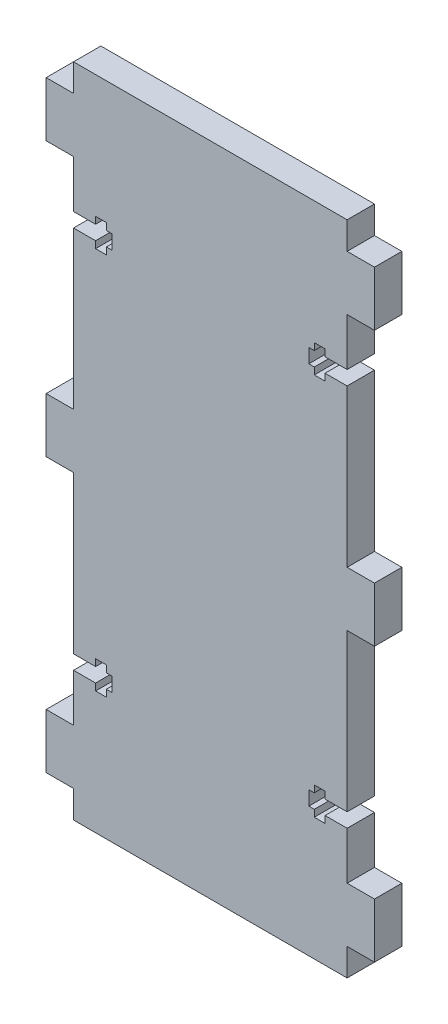
from build123d import *

# Parameters (mm, degrees)
SKETCH1_W           = 63.5
SKETCH1_H           = 152.4
BOSS_EXTRUDE1_DEPTH = 6.35
SKETCH2_W           = 6.35
SKETCH2_H           = 12.7
BOSS_EXTRUDE3_DEPTH = 6.35
SKETCH4_W           = 8.89
SKETCH4_H           = 3.302
SKETCH4_W_2         = 2.5
SKETCH4_H_2         = 6.5
CUT_EXTRUDE4_DEPTH  = 6.35


with BuildPart() as part:
    # Sketch1 → Boss-Extrude1 (new body)
    with BuildSketch(Plane.XY):
        with Locations((31.75, 76.2)):
            Rectangle(SKETCH1_W, SKETCH1_H)
    extrude(amount=BOSS_EXTRUDE1_DEPTH)

    # Sketch2 → Boss-Extrude3 (add)
    with BuildSketch(Plane.XY.offset(6.35)):
        with Locations((-3.175, 76.2)):
            Rectangle(SKETCH2_W, SKETCH2_H)
        with Locations((66.675, 139.7)):
            Rectangle(SKETCH2_W, SKETCH2_H)
        with Locations((66.675, 76.2)):
            Rectangle(SKETCH2_W, SKETCH2_H)
        with Locations((66.675, 12.7)):
            Rectangle(SKETCH2_W, SKETCH2_H)
        with Locations((-3.175, 12.7)):
            Rectangle(SKETCH2_W, SKETCH2_H)
        with Locations((-3.175, 139.7)):
            Rectangle(SKETCH2_W, SKETCH2_H)
    extrude(amount=-BOSS_EXTRUDE3_DEPTH)

    # Sketch4 → Cut-Extrude4 (cut)
    with BuildSketch(Plane.XY.offset(6.35)):
        with Locations((4.445, 120.65)):
            Rectangle(SKETCH4_W, SKETCH4_H)
        with Locations((6.37, 120.65)):
            Rectangle(SKETCH4_W_2, SKETCH4_H_2)
        with Locations((6.37, 31.75)):
            Rectangle(SKETCH4_W_2, SKETCH4_H_2)
        with Locations((4.445, 31.75)):
            Rectangle(SKETCH4_W, SKETCH4_H)
        with Locations((59.055, 31.75)):
            Rectangle(SKETCH4_W, SKETCH4_H)
        with Locations((57.13, 31.75)):
            Rectangle(SKETCH4_W_2, SKETCH4_H_2)
        with Locations((57.13, 120.65)):
            Rectangle(SKETCH4_W_2, SKETCH4_H_2)
        with Locations((59.055, 120.65)):
            Rectangle(SKETCH4_W, SKETCH4_H)
    extrude(amount=-CUT_EXTRUDE4_DEPTH, mode=Mode.SUBTRACT)


solid = part.part
